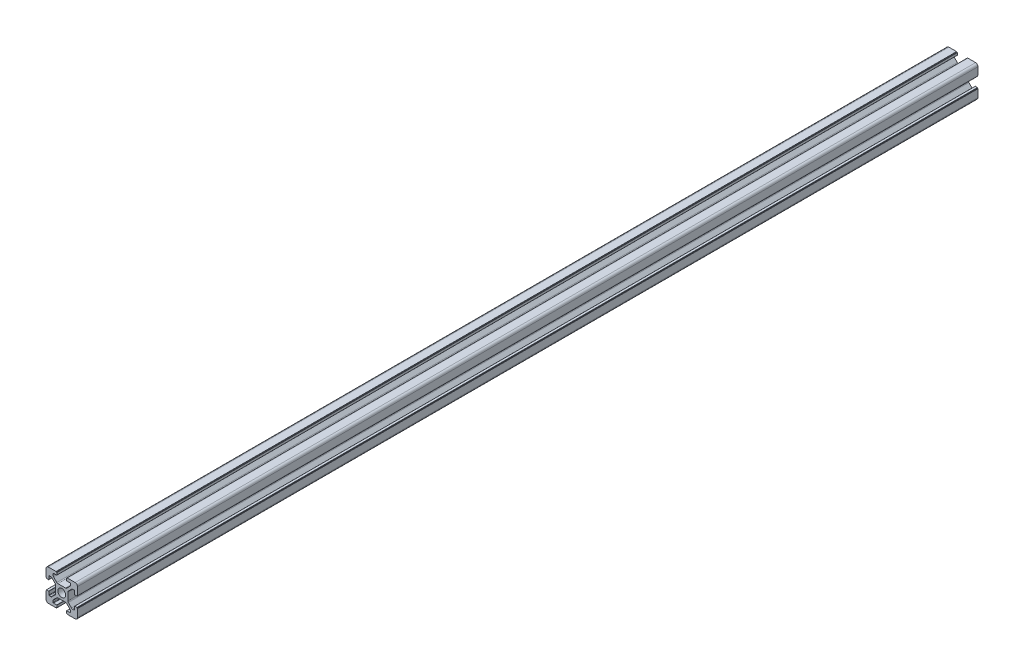
from build123d import *

# Parameters (mm, degrees)
SKETCH_1_R      = 2.5
EXTRUDE_1_DEPTH = 572
FILLET_1_R      = 1.5


with BuildPart() as part:
    # 草图1 → 凸台-拉伸1 (new body)
    with BuildSketch(Plane.XY):
        with BuildLine():
            Line((20, 13.6), (20, 20))
            Line((20, 20), (13.6, 20))
            Line((13.6, 20), (13.6, 19.8))
            Line((13.6, 19.8), (13.2, 19.8))
            ThreePointArc((13.2, 19.8), (13.129289322, 19.770710678), (13.1, 19.7))
            Line((13.1, 19.7), (13.1, 18.3))
            ThreePointArc((13.1, 18.3), (13.129289322, 18.229289322), (13.2, 18.2))
            Line((13.2, 18.2), (15.2, 18.2))
            ThreePointArc((15.2, 18.2), (15.412132034, 18.112132034), (15.5, 17.9))
            Line((15.5, 17.9), (15.5, 16.974873734))
            ThreePointArc((15.5, 16.974873734), (15.423879533, 16.592190302), (15.207106781, 16.267766953))
            Line((15.207106781, 16.267766953), (13.132233047, 14.192893219))
            ThreePointArc((13.132233047, 14.192893219), (12.807809698, 13.976120467), (12.425126266, 13.9))
            Line((12.425126266, 13.9), (7.574873734, 13.9))
            ThreePointArc((7.574873734, 13.9), (7.192190302, 13.976120467), (6.867766953, 14.192893219))
            Line((6.867766953, 14.192893219), (4.792893219, 16.267766953))
            ThreePointArc((4.792893219, 16.267766953), (4.576120467, 16.592190302), (4.5, 16.974873734))
            Line((4.5, 16.974873734), (4.5, 17.9))
            ThreePointArc((4.5, 17.9), (4.587867966, 18.112132034), (4.8, 18.2))
            Line((4.8, 18.2), (6.8, 18.2))
            ThreePointArc((6.8, 18.2), (6.870710678, 18.229289322), (6.9, 18.3))
            Line((6.9, 18.3), (6.9, 19.7))
            ThreePointArc((6.9, 19.7), (6.870710678, 19.770710678), (6.8, 19.8))
            Line((6.8, 19.8), (6.4, 19.8))
            Line((6.4, 19.8), (6.4, 20))
            Line((6.4, 20), (0, 20))
            Line((0, 20), (0, 13.6))
            Line((0, 13.6), (0.2, 13.6))
            Line((0.2, 13.6), (0.2, 13.2))
            ThreePointArc((0.2, 13.2), (0.229289322, 13.129289322), (0.3, 13.1))
            Line((0.3, 13.1), (1.7, 13.1))
            ThreePointArc((1.7, 13.1), (1.770710678, 13.129289322), (1.8, 13.2))
            Line((1.8, 13.2), (1.8, 15.2))
            ThreePointArc((1.8, 15.2), (1.887867966, 15.412132034), (2.1, 15.5))
            Line((2.1, 15.5), (3.025126266, 15.5))
            ThreePointArc((3.025126266, 15.5), (3.407809698, 15.423879533), (3.732233047, 15.207106781))
            Line((3.732233047, 15.207106781), (5.807106781, 13.132233047))
            ThreePointArc((5.807106781, 13.132233047), (6.023879533, 12.807809698), (6.1, 12.425126266))
            Line((6.1, 12.425126266), (6.1, 7.574873734))
            ThreePointArc((6.1, 7.574873734), (6.023879533, 7.192190302), (5.807106781, 6.867766953))
            Line((5.807106781, 6.867766953), (3.732233047, 4.792893219))
            ThreePointArc((3.732233047, 4.792893219), (3.407809698, 4.576120467), (3.025126266, 4.5))
            Line((3.025126266, 4.5), (2.1, 4.5))
            ThreePointArc((2.1, 4.5), (1.887867966, 4.587867966), (1.8, 4.8))
            Line((1.8, 4.8), (1.8, 6.8))
            ThreePointArc((1.8, 6.8), (1.770710678, 6.870710678), (1.7, 6.9))
            Line((1.7, 6.9), (0.3, 6.9))
            ThreePointArc((0.3, 6.9), (0.229289322, 6.870710678), (0.2, 6.8))
            Line((0.2, 6.8), (0.2, 6.4))
            Line((0.2, 6.4), (0, 6.4))
            Line((0, 6.4), (0, 0))
            Line((0, 0), (6.4, 0))
            Line((6.4, 0), (6.4, 0.2))
            Line((6.4, 0.2), (6.8, 0.2))
            ThreePointArc((6.8, 0.2), (6.870710678, 0.229289322), (6.9, 0.3))
            Line((6.9, 0.3), (6.9, 1.7))
            ThreePointArc((6.9, 1.7), (6.870710678, 1.770710678), (6.8, 1.8))
            Line((6.8, 1.8), (4.8, 1.8))
            ThreePointArc((4.8, 1.8), (4.587867966, 1.887867966), (4.5, 2.1))
            Line((4.5, 2.1), (4.5, 3.025126266))
            ThreePointArc((4.5, 3.025126266), (4.576120467, 3.407809698), (4.792893219, 3.732233047))
            Line((4.792893219, 3.732233047), (6.867766953, 5.807106781))
            ThreePointArc((6.867766953, 5.807106781), (7.192190302, 6.023879533), (7.574873734, 6.1))
            Line((7.574873734, 6.1), (12.425126266, 6.1))
            ThreePointArc((12.425126266, 6.1), (12.807809698, 6.023879533), (13.132233047, 5.807106781))
            Line((13.132233047, 5.807106781), (15.207106781, 3.732233047))
            ThreePointArc((15.207106781, 3.732233047), (15.423879533, 3.407809698), (15.5, 3.025126266))
            Line((15.5, 3.025126266), (15.5, 2.1))
            ThreePointArc((15.5, 2.1), (15.412132034, 1.887867966), (15.2, 1.8))
            Line((15.2, 1.8), (13.2, 1.8))
            ThreePointArc((13.2, 1.8), (13.129289322, 1.770710678), (13.1, 1.7))
            Line((13.1, 1.7), (13.1, 0.3))
            ThreePointArc((13.1, 0.3), (13.129289322, 0.229289322), (13.2, 0.2))
            Line((13.2, 0.2), (13.6, 0.2))
            Line((13.6, 0.2), (13.6, 0))
            Line((13.6, 0), (20, 0))
            Line((20, 0), (20, 6.4))
            Line((20, 6.4), (19.8, 6.4))
            Line((19.8, 6.4), (19.8, 6.8))
            ThreePointArc((19.8, 6.8), (19.770710678, 6.870710678), (19.7, 6.9))
            Line((19.7, 6.9), (18.3, 6.9))
            ThreePointArc((18.3, 6.9), (18.229289322, 6.870710678), (18.2, 6.8))
            Line((18.2, 6.8), (18.2, 4.8))
            ThreePointArc((18.2, 4.8), (18.112132034, 4.587867966), (17.9, 4.5))
            Line((17.9, 4.5), (16.974873734, 4.5))
            ThreePointArc((16.974873734, 4.5), (16.592190302, 4.576120467), (16.267766953, 4.792893219))
            Line((16.267766953, 4.792893219), (14.192893219, 6.867766953))
            ThreePointArc((14.192893219, 6.867766953), (13.976120467, 7.192190302), (13.9, 7.574873734))
            Line((13.9, 7.574873734), (13.9, 12.425126266))
            ThreePointArc((13.9, 12.425126266), (13.976120467, 12.807809698), (14.192893219, 13.132233047))
            Line((14.192893219, 13.132233047), (16.267766953, 15.207106781))
            ThreePointArc((16.267766953, 15.207106781), (16.592190302, 15.423879533), (16.974873734, 15.5))
            Line((16.974873734, 15.5), (17.9, 15.5))
            ThreePointArc((17.9, 15.5), (18.112132034, 15.412132034), (18.2, 15.2))
            Line((18.2, 15.2), (18.2, 13.2))
            ThreePointArc((18.2, 13.2), (18.229289322, 13.129289322), (18.3, 13.1))
            Line((18.3, 13.1), (19.7, 13.1))
            ThreePointArc((19.7, 13.1), (19.770710678, 13.129289322), (19.8, 13.2))
            Line((19.8, 13.2), (19.8, 13.6))
            Line((19.8, 13.6), (20, 13.6))
        make_face()
        with Locations((10, 10)):
            Circle(SKETCH_1_R, mode=Mode.SUBTRACT)
    extrude(amount=EXTRUDE_1_DEPTH)

    # 圆角1
    fillet_1_edges = [part.edges().sort_by_distance(p)[0] for p in [
        (0, 0, 286),
        (0, 20, 286),
        (20, 20, 286),
        (20, 0, 286),
    ]]
    fillet(fillet_1_edges, radius=FILLET_1_R)


solid = part.part
